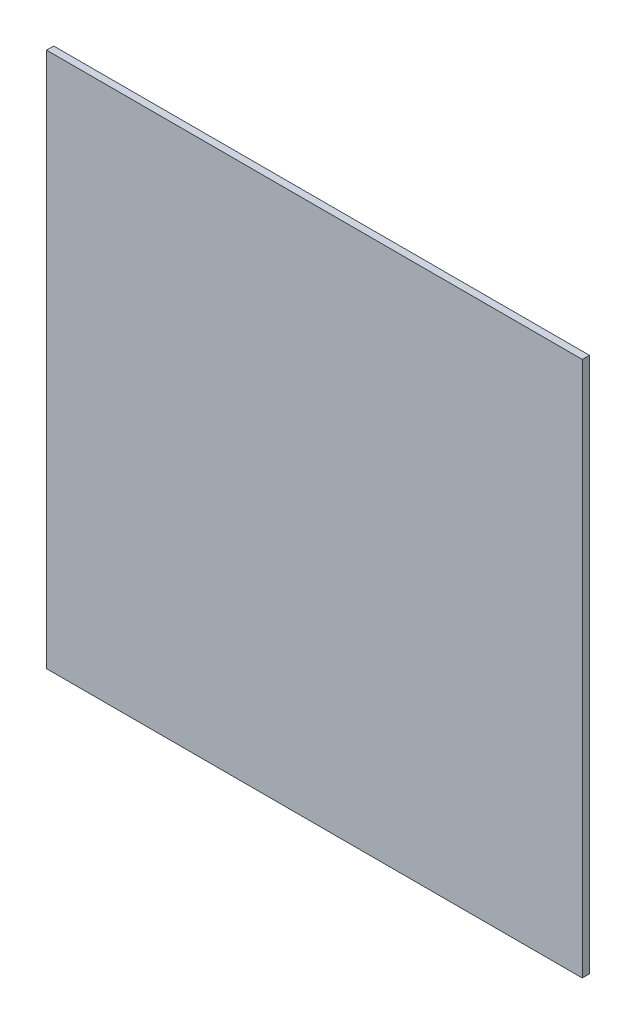
from build123d import *

# Parameters (mm, degrees)
SKETCH1_W           = 224
SKETCH1_H           = 224
BOSS_EXTRUDE1_DEPTH = 3


with BuildPart() as part:
    # Sketch1 → Boss-Extrude1 (new body)
    with BuildSketch(Plane.XY):
        with Locations((112, 112)):
            Rectangle(SKETCH1_W, SKETCH1_H)
    extrude(amount=BOSS_EXTRUDE1_DEPTH)


solid = part.part
